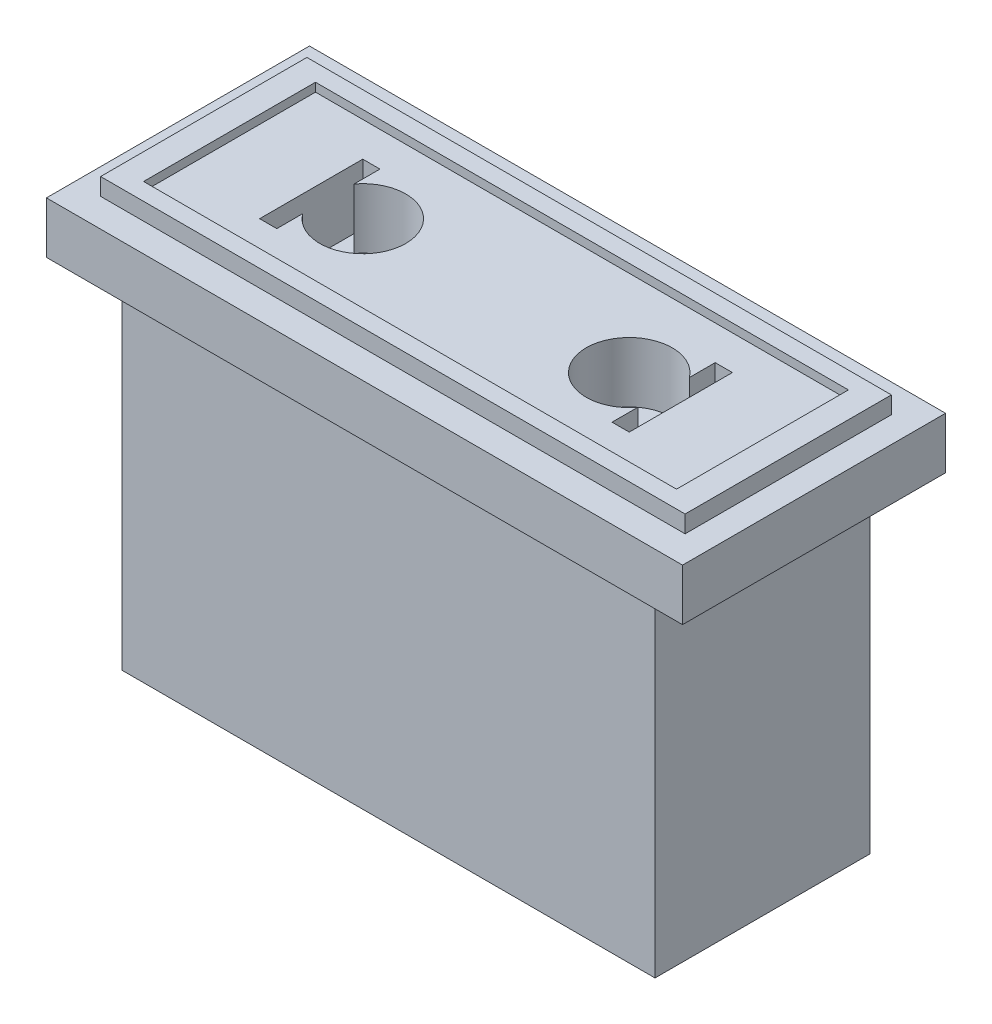
from build123d import *

# Parameters (mm, degrees)
SKETCH1_W           = 37
SKETCH1_H           = 15.3
BOSS_EXTRUDE1_DEPTH = 3
SKETCH2_W           = 34
SKETCH2_H           = 12
BOSS_EXTRUDE2_DEPTH = 1
SKETCH3_W           = 31
SKETCH3_H           = 10
CUT_EXTRUDE1_DEPTH  = 0.5
CUT_EXTRUDE2_DEPTH  = 5
SKETCH5_W           = 31
SKETCH5_H           = 12.5
BOSS_EXTRUDE3_DEPTH = 20


with BuildPart() as part:
    # Sketch1 → Boss-Extrude1 (new body)
    with BuildSketch(Plane(origin=(0, 0, 0), x_dir=(1, 0, 0), z_dir=(0, 1, 0))):
        Rectangle(SKETCH1_W, SKETCH1_H)
    extrude(amount=BOSS_EXTRUDE1_DEPTH)

    # Sketch2 → Boss-Extrude2 (add)
    with BuildSketch(Plane(origin=(0, 3, 0), x_dir=(1, 0, 0), z_dir=(0, 1, 0))):
        Rectangle(SKETCH2_W, SKETCH2_H)
    extrude(amount=BOSS_EXTRUDE2_DEPTH)

    # Sketch3 → Cut-Extrude1 (cut)
    with BuildSketch(Plane(origin=(0, 4, 0), x_dir=(1, 0, 0), z_dir=(0, 1, 0))):
        Rectangle(SKETCH3_W, SKETCH3_H)
    extrude(amount=-CUT_EXTRUDE1_DEPTH, mode=Mode.SUBTRACT)

    # Sketch4 → Cut-Extrude2 (cut)
    with BuildSketch(Plane(origin=(0, 3.5, 0), x_dir=(1, 0, 0), z_dir=(0, 1, 0))):
        with BuildLine():
            Line((-10.75, 3), (-9.75, 3))
            Line((-9.75, 3), (-9.75, 1.5))
            ThreePointArc((-9.75, 1.5), (-5.25, 0), (-9.75, -1.5))
            Line((-9.75, -1.5), (-9.75, -3))
            Line((-9.75, -3), (-10.75, -3))
            Line((-10.75, -3), (-10.75, 3))
        make_face()
        with BuildLine():
            Line((9.75, -1.5), (9.75, -3))
            Line((9.75, -3), (10.75, -3))
            Line((10.75, -3), (10.75, 3))
            Line((10.75, 3), (9.75, 3))
            Line((9.75, 3), (9.75, 1.5))
            ThreePointArc((9.75, 1.5), (5.25, 0), (9.75, -1.5))
        make_face()
    extrude(amount=-CUT_EXTRUDE2_DEPTH, mode=Mode.SUBTRACT)

    # Sketch5 → Boss-Extrude3 (add)
    with BuildSketch(Plane.XZ):
        Rectangle(SKETCH5_W, SKETCH5_H)
    extrude(amount=BOSS_EXTRUDE3_DEPTH)


solid = part.part
